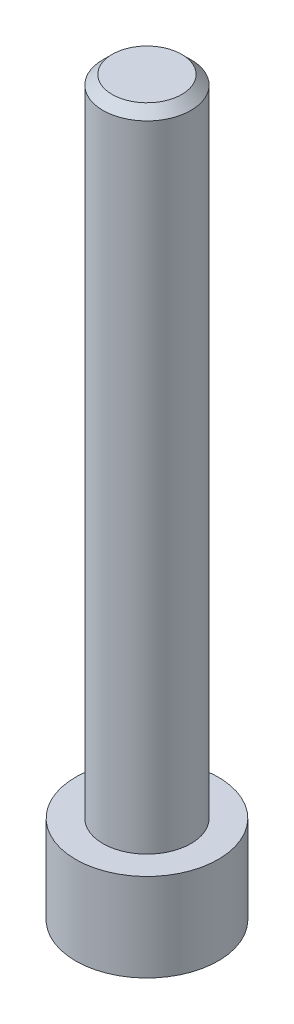
from build123d import *

# Parameters (mm, degrees)
SKETCH1_R           = 3.875
BOSS_EXTRUDE1_DEPTH = 39.78
SKETCH2_OUTSIDE_W   = 18.002
SKETCH2_OUTSIDE_H   = 18.002
SKETCH2_OUTSIDE_R   = 2.39
CUT_EXTRUDE1_DEPTH  = 35
CHAMFER1_SIZE       = 0.5
CUT_EXTRUDE2_DEPTH  = 3.36


with BuildPart() as part:
    # Sketch1 → Boss-Extrude1 (new body)
    with BuildSketch(Plane(origin=(0, 0, 0), x_dir=(1, 0, 0), z_dir=(0, 1, 0))):
        with Locations(Location((0, 0, 0), (0, 0, 270))):
            Circle(SKETCH1_R)
    extrude(amount=BOSS_EXTRUDE1_DEPTH)

    # Sketch2 outside → Cut-Extrude1 (cut)
    with BuildSketch(Plane(origin=(0, 39.78, 0), x_dir=(1, 0, 0), z_dir=(0, 1, 0))):
        Rectangle(SKETCH2_OUTSIDE_W, SKETCH2_OUTSIDE_H)
        with Locations(Location((0, 0, 0), (0, 0, 270))):
            Circle(SKETCH2_OUTSIDE_R, mode=Mode.SUBTRACT)
    extrude(amount=-CUT_EXTRUDE1_DEPTH, mode=Mode.SUBTRACT)

    # Chamfer1
    chamfer1_edges = [part.edges().sort_by_distance(p)[0] for p in [
        (0, 39.78, -2.39),
    ]]
    chamfer(chamfer1_edges, length=CHAMFER1_SIZE)

    # Sketch8 → Cut-Extrude2 (cut)
    with BuildSketch(Plane.XZ):
        Polygon((2.644264233, 0), (1.322132116, 2.29), (-1.322132116, 2.29), (-2.644264233, 0), (-1.322132116, -2.29), (1.322132116, -2.29), align=None)
    extrude(amount=-CUT_EXTRUDE2_DEPTH, mode=Mode.SUBTRACT)


solid = part.part
